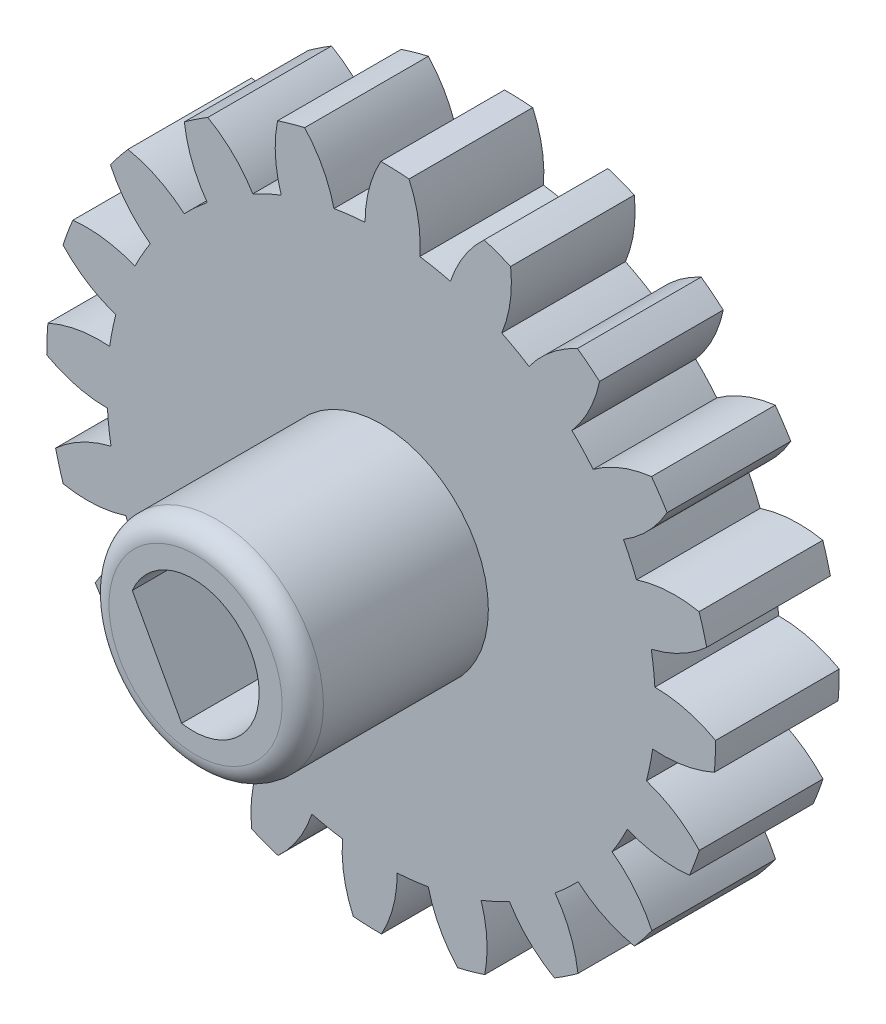
from build123d import *

# Parameters (mm, degrees)
EXTRUDE_4_DEPTH     = 3
SKETCH_5_R          = 2.6
EXTRUDE_6_DEPTH     = 4.5
FILLET_1_R          = 0.5
CUT_EXTRUDE_1_DEPTH = 14.702930219


with BuildPart() as part:
    # 草图4 → 凸台-拉伸4 (new body)
    with BuildSketch(Plane.XY):
        with BuildLine():
            ThreePointArc((8.109259925, 0.007195304), (7.397764467, 0.292254868), (6.637585045, 0.390295618))
            ThreePointArc((6.637585045, 0.390295618), (6.604507127, 0.768343357), (6.549914936, 1.143888207))
            ThreePointArc((6.549914936, 1.143888207), (7.267285645, 1.413821546), (7.894339522, 1.854602872))
            ThreePointArc((7.894339522, 1.854602872), (7.809176661, 2.185613911), (7.710141023, 2.512742269))
            ThreePointArc((7.710141023, 2.512742269), (6.945380381, 2.563985838), (6.192110531, 2.422319772))
            ThreePointArc((6.192110531, 2.422319772), (6.043828385, 2.771642898), (5.875858386, 3.11193736))
            ThreePointArc((5.875858386, 3.11193736), (6.474704484, 3.590338961), (6.934859239, 4.203317219))
            ThreePointArc((6.934859239, 4.203317219), (6.751576509, 4.491810653), (6.556299797, 4.772324514))
            ThreePointArc((6.556299797, 4.772324514), (5.813134073, 4.584736009), (5.140509095, 4.217230388))
            ThreePointArc((5.140509095, 4.217230388), (4.891537611, 4.503634721), (4.626631877, 4.775368402))
            ThreePointArc((4.626631877, 4.775368402), (5.048334136, 5.415408984), (5.296546615, 6.140581589))
            ThreePointArc((5.296546615, 6.140581589), (5.033085007, 6.358317671), (4.760682268, 6.564758384))
            ThreePointArc((4.760682268, 6.564758384), (4.111857698, 6.156700276), (3.585718812, 5.599329112))
            ThreePointArc((3.585718812, 5.599329112), (3.260429054, 5.794779399), (2.924518404, 5.971353113))
            ThreePointArc((2.924518404, 5.971353113), (3.127797669, 6.710381044), (3.139771106, 7.47676305))
            ThreePointArc((3.139771106, 7.47676305), (2.821920077, 7.602428255), (2.499055988, 7.714587965))
            ThreePointArc((2.499055988, 7.714587965), (2.008084044, 7.126003823), (1.67993339, 6.433326489))
            ThreePointArc((1.67993339, 6.433326489), (1.310166985, 6.518690695), (0.936132694, 6.582820177))
            ThreePointArc((0.936132694, 6.582820177), (0.901090574, 7.348494254), (0.675652925, 8.081066849))
            ThreePointArc((0.675652925, 8.081066849), (0.334525948, 8.102360192), (-0.007195304, 8.109259925))
            ThreePointArc((-0.007195304, 8.109259925), (-0.292254868, 7.397764467), (-0.390295618, 6.637585045))
            ThreePointArc((-0.390295618, 6.637585045), (-0.768343357, 6.604507127), (-1.143888207, 6.549914936))
            ThreePointArc((-1.143888207, 6.549914936), (-1.413821546, 7.267285645), (-1.854602872, 7.894339522))
            ThreePointArc((-1.854602872, 7.894339522), (-2.185613911, 7.809176661), (-2.512742269, 7.710141023))
            ThreePointArc((-2.512742269, 7.710141023), (-2.563985838, 6.945380381), (-2.422319772, 6.192110531))
            ThreePointArc((-2.422319772, 6.192110531), (-2.771642898, 6.043828385), (-3.11193736, 5.875858386))
            ThreePointArc((-3.11193736, 5.875858386), (-3.590338961, 6.474704484), (-4.203317219, 6.934859239))
            ThreePointArc((-4.203317219, 6.934859239), (-4.491810653, 6.751576509), (-4.772324514, 6.556299797))
            ThreePointArc((-4.772324514, 6.556299797), (-4.584736009, 5.813134073), (-4.217230388, 5.140509095))
            ThreePointArc((-4.217230388, 5.140509095), (-4.503634721, 4.891537611), (-4.775368402, 4.626631877))
            ThreePointArc((-4.775368402, 4.626631877), (-5.415408984, 5.048334136), (-6.140581589, 5.296546615))
            ThreePointArc((-6.140581589, 5.296546615), (-6.358317671, 5.033085007), (-6.564758384, 4.760682268))
            ThreePointArc((-6.564758384, 4.760682268), (-6.156700276, 4.111857698), (-5.599329112, 3.585718812))
            ThreePointArc((-5.599329112, 3.585718812), (-5.794779399, 3.260429054), (-5.971353113, 2.924518404))
            ThreePointArc((-5.971353113, 2.924518404), (-6.710381044, 3.127797669), (-7.47676305, 3.139771106))
            ThreePointArc((-7.47676305, 3.139771106), (-7.602428255, 2.821920077), (-7.714587965, 2.499055988))
            ThreePointArc((-7.714587965, 2.499055988), (-7.126003823, 2.008084044), (-6.433326489, 1.67993339))
            ThreePointArc((-6.433326489, 1.67993339), (-6.518690695, 1.310166985), (-6.582820177, 0.936132694))
            ThreePointArc((-6.582820177, 0.936132694), (-7.348494254, 0.901090574), (-8.081066849, 0.675652925))
            ThreePointArc((-8.081066849, 0.675652925), (-8.102360192, 0.334525948), (-8.109259925, -0.007195304))
            ThreePointArc((-8.109259925, -0.007195304), (-7.397764467, -0.292254868), (-6.637585045, -0.390295618))
            ThreePointArc((-6.637585045, -0.390295618), (-6.604507127, -0.768343357), (-6.549914936, -1.143888207))
            ThreePointArc((-6.549914936, -1.143888207), (-7.267285646, -1.413821546), (-7.894339522, -1.854602872))
            ThreePointArc((-7.894339522, -1.854602872), (-7.809176662, -2.185613911), (-7.710141023, -2.512742269))
            ThreePointArc((-7.710141023, -2.512742269), (-6.945380381, -2.563985838), (-6.192110531, -2.422319772))
            ThreePointArc((-6.192110531, -2.422319772), (-6.043828385, -2.771642898), (-5.875858386, -3.11193736))
            ThreePointArc((-5.875858386, -3.11193736), (-6.474704484, -3.590338961), (-6.934859239, -4.203317219))
            ThreePointArc((-6.934859239, -4.203317219), (-6.751576509, -4.491810653), (-6.556299797, -4.772324514))
            ThreePointArc((-6.556299797, -4.772324514), (-5.813134073, -4.584736009), (-5.140509095, -4.217230388))
            ThreePointArc((-5.140509095, -4.217230388), (-4.891537611, -4.503634721), (-4.626631877, -4.775368402))
            ThreePointArc((-4.626631877, -4.775368402), (-5.048334136, -5.415408984), (-5.296546615, -6.140581589))
            ThreePointArc((-5.296546615, -6.140581589), (-5.033085007, -6.358317671), (-4.760682268, -6.564758384))
            ThreePointArc((-4.760682268, -6.564758384), (-4.111857698, -6.156700276), (-3.585718813, -5.599329112))
            ThreePointArc((-3.585718813, -5.599329112), (-3.260429054, -5.794779399), (-2.924518404, -5.971353114))
            ThreePointArc((-2.924518404, -5.971353114), (-3.127797669, -6.710381044), (-3.139771106, -7.47676305))
            ThreePointArc((-3.139771106, -7.47676305), (-2.821920077, -7.602428255), (-2.499055988, -7.714587965))
            ThreePointArc((-2.499055988, -7.714587965), (-2.008084044, -7.126003823), (-1.67993339, -6.433326489))
            ThreePointArc((-1.67993339, -6.433326489), (-1.310166985, -6.518690695), (-0.936132694, -6.582820177))
            ThreePointArc((-0.936132694, -6.582820177), (-0.901090574, -7.348494254), (-0.675652925, -8.081066849))
            ThreePointArc((-0.675652925, -8.081066849), (-0.334525948, -8.102360192), (0.007195304, -8.109259925))
            ThreePointArc((0.007195304, -8.109259925), (0.292254868, -7.397764467), (0.390295618, -6.637585045))
            ThreePointArc((0.390295618, -6.637585045), (0.768343357, -6.604507127), (1.143888207, -6.549914936))
            ThreePointArc((1.143888207, -6.549914936), (1.413821546, -7.267285645), (1.854602872, -7.894339522))
            ThreePointArc((1.854602872, -7.894339522), (2.185613911, -7.809176661), (2.512742269, -7.710141023))
            ThreePointArc((2.512742269, -7.710141023), (2.563985838, -6.945380381), (2.422319772, -6.192110531))
            ThreePointArc((2.422319772, -6.192110531), (2.771642898, -6.043828385), (3.11193736, -5.875858386))
            ThreePointArc((3.11193736, -5.875858386), (3.590338961, -6.474704484), (4.203317219, -6.934859239))
            ThreePointArc((4.203317219, -6.934859239), (4.491810653, -6.751576509), (4.772324514, -6.556299797))
            ThreePointArc((4.772324514, -6.556299797), (4.584736009, -5.813134073), (4.217230388, -5.140509095))
            ThreePointArc((4.217230388, -5.140509095), (4.503634721, -4.891537611), (4.775368402, -4.626631877))
            ThreePointArc((4.775368402, -4.626631877), (5.415408984, -5.048334136), (6.140581589, -5.296546615))
            ThreePointArc((6.140581589, -5.296546615), (6.358317671, -5.033085007), (6.564758384, -4.760682268))
            ThreePointArc((6.564758384, -4.760682268), (6.156700276, -4.111857698), (5.599329112, -3.585718812))
            ThreePointArc((5.599329112, -3.585718812), (5.794779399, -3.260429054), (5.971353113, -2.924518404))
            ThreePointArc((5.971353113, -2.924518404), (6.710381044, -3.127797669), (7.47676305, -3.139771106))
            ThreePointArc((7.47676305, -3.139771106), (7.602428255, -2.821920077), (7.714587965, -2.499055988))
            ThreePointArc((7.714587965, -2.499055988), (7.126003823, -2.008084044), (6.433326489, -1.67993339))
            ThreePointArc((6.433326489, -1.67993339), (6.518690695, -1.310166985), (6.582820177, -0.936132694))
            ThreePointArc((6.582820177, -0.936132694), (7.348494254, -0.901090574), (8.081066849, -0.675652925))
            ThreePointArc((8.081066849, -0.675652925), (8.102210984, -0.338120505), (8.109263117, 0))
            ThreePointArc((8.109263117, 0), (8.109262319, 0.003597652), (8.109259925, 0.007195304))
        make_face()
    extrude(amount=EXTRUDE_4_DEPTH)

    # 草图5 → 凸台-拉伸6 (add)
    with BuildSketch(Plane.XY.offset(3)):
        Circle(SKETCH_5_R)
    extrude(amount=EXTRUDE_6_DEPTH)

    # 圆角1
    fillet_1_edges = [part.edges().sort_by_distance(p)[0] for p in [
        (-2.6, 0, 7.5),
    ]]
    fillet(fillet_1_edges, radius=FILLET_1_R)

    # 草图8 → 切除-拉伸1 (cut, through all)
    with BuildSketch(Plane(origin=(0, 0, 0), x_dir=(-1, 0, 0), z_dir=(0, 0, -1))):
        with BuildLine():
            Line((0.33826518, -1.607281695), (1.534533807, 0.585648166))
            ThreePointArc((1.534533807, 0.585648166), (-1.346074271, 0.734299099), (0.33826518, -1.607281695))
        make_face()
    extrude(amount=-CUT_EXTRUDE_1_DEPTH, mode=Mode.SUBTRACT)


solid = part.part
